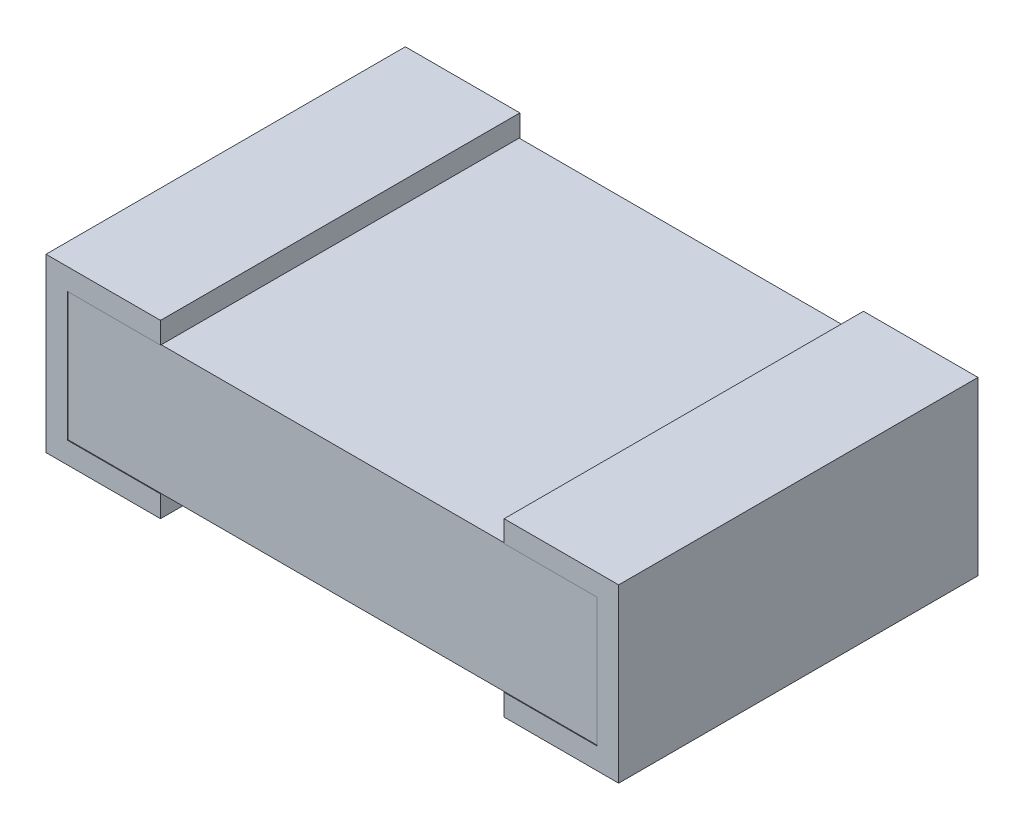
from build123d import *

# Parameters (mm, degrees)
SKETCH1_W           = 1.8796
SKETCH1_H           = 0.4572
BASE_EXTRUDE_DEPTH  = 0.635
BOSS_EXTRUDE1_DEPTH = 1.27508


with BuildPart() as part:
    # Sketch1 → Base-Extrude (new, symmetric)
    with BuildSketch(Plane.XY):
        with Locations((1.016, 0.3048)):
            Rectangle(SKETCH1_W, SKETCH1_H)
    extrude(amount=BASE_EXTRUDE_DEPTH, both=True)

    # Sketch2 → Boss-Extrude1 (add)
    with BuildSketch(Plane(origin=(0, 0, -0.63754), x_dir=(-1, 0, 0), z_dir=(0, 0, -1))):
        Polygon((0, 0), (-0.4064, 0), (-0.4064, 0.0762), (-0.0762, 0.0762), (-0.0762, 0.5334), (-0.4064, 0.5334), (-0.4064, 0.6096), (0, 0.6096), align=None)
    boss_extrude1 = extrude(amount=-BOSS_EXTRUDE1_DEPTH)

    # Mirror1: Boss-Extrude1 across plane
    add(boss_extrude1.mirror(Plane(origin=(1.016, 0, 0), x_dir=(0, 0, 1), z_dir=(1, 0, 0))))


solid = part.part
